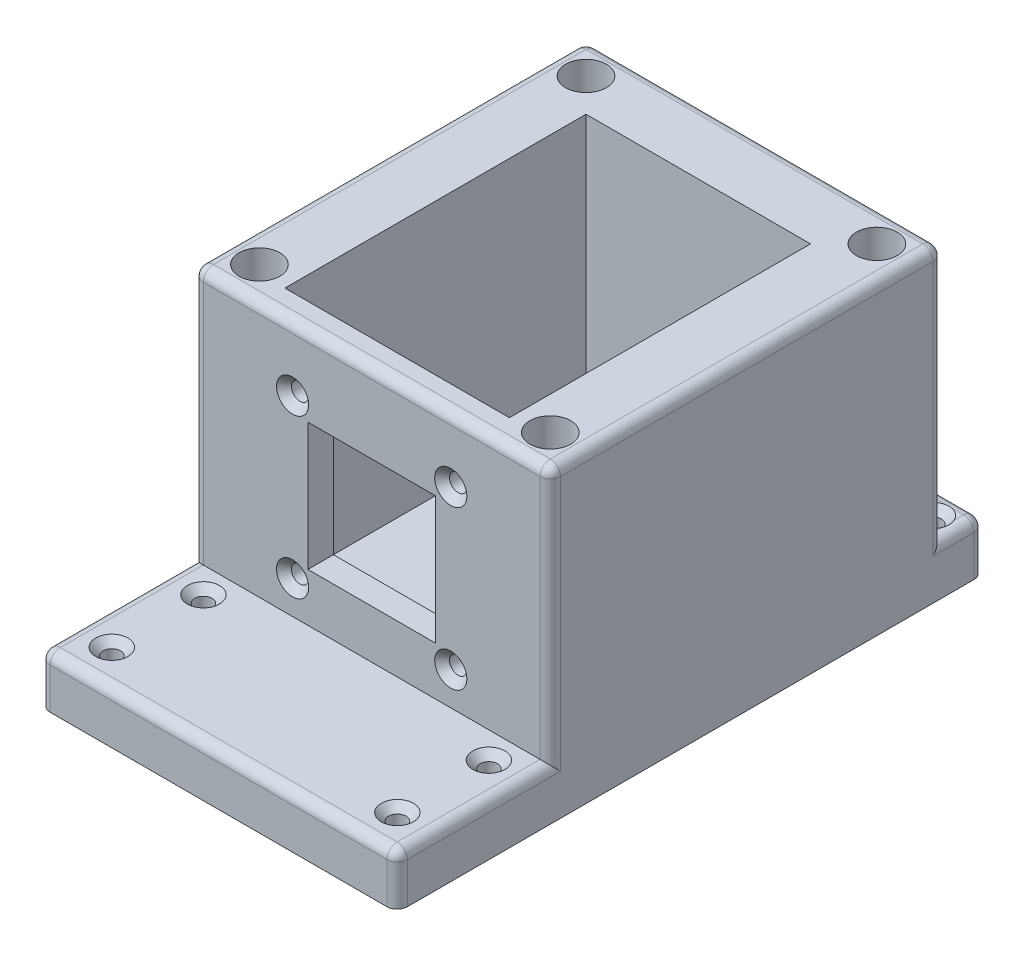
from build123d import *

# Parameters (mm, degrees)
SKETCH2_W                                           = 70
SKETCH2_H                                           = 115
BOSS_EXTRUDE1_DEPTH                                 = 10
SKETCH8_W                                           = 70
SKETCH8_H                                           = 77
SKETCH8_W_2                                         = 44
SKETCH8_H_2                                         = 59
BOSS_EXTRUDE5_DEPTH                                 = 50
SKETCH9_R                                           = 4
CUT_EXTRUDE1_DEPTH                                  = 50
CUT_EXTRUDE2_REACH                                  = 107.948
SKETCH10_W                                          = 25
SKETCH10_H                                          = 25
CSK_FOR_M3_COUNTERSUNK_FLAT_HEAD_SCREW1_D           = 3.4
CSK_FOR_M3_COUNTERSUNK_FLAT_HEAD_SCREW1_DEPTH       = 5
CSK_FOR_M3_COUNTERSUNK_FLAT_HEAD_SCREW1_CSINK_D     = 6.3
CSK_FOR_M3_COUNTERSUNK_FLAT_HEAD_SCREW1_CSINK_ANGLE = 90
FILLET1_R                                           = 2
CSK_FOR_M3_COUNTERSUNK_FLAT_HEAD_SCR_2_COUNT        = 2
CSK_FOR_M3_COUNTERSUNK_FLAT_HEAD_SCR_2_PITCH        = 59.993922781
CSK_FOR_M3_COUNTERSUNK_FLAT_HEAD_SCR_3_COUNT        = 2
CSK_FOR_M3_COUNTERSUNK_FLAT_HEAD_SCR_3_PITCH        = 84.983361201
CSK_FOR_M3_COUNTERSUNK_FLAT_HEAD_SCR_4_COUNT        = 2
CSK_FOR_M3_COUNTERSUNK_FLAT_HEAD_SCR_4_PITCH        = 102.955177918
CSK_FOR_M3_COUNTERSUNK_FLAT_HEAD_SCR_5_COUNT        = 2
CSK_FOR_M3_COUNTERSUNK_FLAT_HEAD_SCR_5_PITCH        = 118.101251225
CSK_FOR_M3_COUNTERSUNK_FLAT_HEAD_SCR_6_COUNT        = 2
CSK_FOR_M3_COUNTERSUNK_FLAT_HEAD_SCR_6_PITCH        = 102.856688561
CSK_FOR_M5_COUNTERSUNK_FLAT_HEAD_SCREW2_D           = 5.5
CSK_FOR_M5_COUNTERSUNK_FLAT_HEAD_SCREW2_DEPTH       = 30
CSK_FOR_M5_COUNTERSUNK_FLAT_HEAD_SCREW2_CSINK_D     = 10.4
CSK_FOR_M5_COUNTERSUNK_FLAT_HEAD_SCREW2_CSINK_ANGLE = 90
CSK_FOR_M5_COUNTERSUNK_FLAT_HEAD_SCREW2_TIP         = 1.652366702


with BuildPart() as part:
    # Sketch2 → Boss-Extrude1 (new body)
    with BuildSketch(Plane(origin=(0, 0, 0), x_dir=(1, 0, 0), z_dir=(0, 1, 0))):
        with Locations((0, 7.5)):
            Rectangle(SKETCH2_W, SKETCH2_H)
    extrude(amount=BOSS_EXTRUDE1_DEPTH)

    # Sketch8 → Boss-Extrude5 (add)
    with BuildSketch(Plane(origin=(0, 10, 0), x_dir=(1, 0, 0), z_dir=(0, 1, 0))):
        with Locations((0, 18.5)):
            Rectangle(SKETCH8_W, SKETCH8_H)
        with Locations((0, 14.5)):
            Rectangle(SKETCH8_W_2, SKETCH8_H_2, mode=Mode.SUBTRACT)
    extrude(amount=BOSS_EXTRUDE5_DEPTH)

    # Sketch9 → Cut-Extrude1 (cut)
    with BuildSketch(Plane(origin=(0, 60, 0), x_dir=(1, 0, 0), z_dir=(0, 1, 0))):
        with Locations(Location((-28.5, 50.5, 0), (0, 0, 270))):
            Circle(SKETCH9_R)
        with Locations(Location((28.5, 50.5, 0), (0, 0, 270))):
            Circle(SKETCH9_R)
        with Locations(Location((28.5, -13.5, 0), (0, 0, 270))):
            Circle(SKETCH9_R)
        with Locations(Location((-28.5, -13.5, 0), (0, 0, 270))):
            Circle(SKETCH9_R)
    extrude(amount=-CUT_EXTRUDE1_DEPTH, mode=Mode.SUBTRACT)

    # Sketch10 → Cut-Extrude2 (cut, up to next)
    with BuildSketch(Plane(origin=(0, 0, 15), x_dir=(-1, 0, 0), z_dir=(0, 0, -1)), mode=Mode.PRIVATE) as cut_extrude2_sk1:
        with Locations((0, 32)):
            Rectangle(SKETCH10_W, SKETCH10_H)
    cut_extrude2_tool1 = extrude(cut_extrude2_sk1.sketch, amount=-CUT_EXTRUDE2_REACH, mode=Mode.PRIVATE) & part.part
    add(cut_extrude2_tool1.solids().sort_by_distance((0, 32, 15))[0], mode=Mode.SUBTRACT)

    # CSK for M3 Countersunk Flat Head Screw1
    with Locations(Plane.XY.offset(20)):
        with Locations((-15.5, 47.5), (15.5, 47.5), (15.5, 16.5), (-15.5, 16.5)):
            CounterSinkHole(CSK_FOR_M3_COUNTERSUNK_FLAT_HEAD_SCREW1_D / 2, CSK_FOR_M3_COUNTERSUNK_FLAT_HEAD_SCREW1_CSINK_D / 2, depth=CSK_FOR_M3_COUNTERSUNK_FLAT_HEAD_SCREW1_DEPTH, counter_sink_angle=CSK_FOR_M3_COUNTERSUNK_FLAT_HEAD_SCREW1_CSINK_ANGLE)

    # Fillet1
    fillet1_edges = [part.edges().sort_by_distance(p)[0] for p in [
        (-35, 10, -61),
        (35, 10, -61),
        (-35, 10, 35),
        (0, 10, 50),
        (-35, 35, 20),
        (35, 35, 20),
        (0, 60, -57),
        (35, 35, -57),
        (-35, 35, -57),
        (0, 60, 20),
        (35, 60, -18.5),
        (-35, 60, -18.5),
        (35, 10, 35),
        (35, 5, 50),
        (-35, 5, 50),
        (-35, 5, -65),
        (35, 5, -65),
        (0, 10, -65),
    ]]
    fillet(fillet1_edges, radius=FILLET1_R)

    # Sketch18 → CSK for M3 Countersunk Flat Head Screw2 (revolve, cut)
    with BuildSketch(Plane(origin=(-29.898999739, 10, -59.914683203), x_dir=(0, 0, 1), z_dir=(1, 0, 0))):
        Polygon((0, 0), (0, 31.021463052), (1.7, 30), (1.7, 1.45), (3.15, 0), align=None)
    csk_for_m3_countersunk_flat_head_screw2 = revolve(axis=Axis((-29.898999739, 16.35, -59.914683203), (0, -1, 0)), mode=Mode.SUBTRACT)

    # CSK for M3 Countersunk Flat Head Scr 2: CSK for M3 Countersunk Flat Head Screw2 ×2
    with Locations(*[Vector(0.999999912683058, 0, 0.00041789218284246394) * (i * CSK_FOR_M3_COUNTERSUNK_FLAT_HEAD_SCR_2_PITCH) for i in range(1, CSK_FOR_M3_COUNTERSUNK_FLAT_HEAD_SCR_2_COUNT)]):
        add(csk_for_m3_countersunk_flat_head_screw2, mode=Mode.SUBTRACT)

    # CSK for M3 Countersunk Flat Head Scr 3: CSK for M3 Countersunk Flat Head Screw2 ×2
    with Locations(*[Vector(0.023234335515626516, 0, 0.9997300463890977) * (i * CSK_FOR_M3_COUNTERSUNK_FLAT_HEAD_SCR_3_PITCH) for i in range(1, CSK_FOR_M3_COUNTERSUNK_FLAT_HEAD_SCR_3_COUNT)]):
        add(csk_for_m3_countersunk_flat_head_screw2, mode=Mode.SUBTRACT)

    # CSK for M3 Countersunk Flat Head Scr 4: CSK for M3 Countersunk Flat Head Screw2 ×2
    with Locations(*[Vector(0.5634477960813598, 0, 0.8261516695444358) * (i * CSK_FOR_M3_COUNTERSUNK_FLAT_HEAD_SCR_4_PITCH) for i in range(1, CSK_FOR_M3_COUNTERSUNK_FLAT_HEAD_SCR_4_COUNT)]):
        add(csk_for_m3_countersunk_flat_head_screw2, mode=Mode.SUBTRACT)

    # CSK for M3 Countersunk Flat Head Scr 5: CSK for M3 Countersunk Flat Head Screw2 ×2
    with Locations(*[Vector(0.4905385745621895, 0, 0.8714194781312243) * (i * CSK_FOR_M3_COUNTERSUNK_FLAT_HEAD_SCR_5_PITCH) for i in range(1, CSK_FOR_M3_COUNTERSUNK_FLAT_HEAD_SCR_5_COUNT)]):
        add(csk_for_m3_countersunk_flat_head_screw2, mode=Mode.SUBTRACT)

    # CSK for M3 Countersunk Flat Head Scr 6: CSK for M3 Countersunk Flat Head Screw2 ×2
    with Locations(*[Vector(0.01850192219633628, 0, 0.9998288247870436) * (i * CSK_FOR_M3_COUNTERSUNK_FLAT_HEAD_SCR_6_PITCH) for i in range(1, CSK_FOR_M3_COUNTERSUNK_FLAT_HEAD_SCR_6_COUNT)]):
        add(csk_for_m3_countersunk_flat_head_screw2, mode=Mode.SUBTRACT)

    # CSK for M5 Countersunk Flat Head Screw2
    with Locations(Plane(origin=(0, 10, 0), x_dir=(1, 0, 0), z_dir=(0, 1, 0))):
        with Locations((0.174986864, 14.411981132)):
            CounterSinkHole(CSK_FOR_M5_COUNTERSUNK_FLAT_HEAD_SCREW2_D / 2, CSK_FOR_M5_COUNTERSUNK_FLAT_HEAD_SCREW2_CSINK_D / 2, depth=CSK_FOR_M5_COUNTERSUNK_FLAT_HEAD_SCREW2_DEPTH, counter_sink_angle=CSK_FOR_M5_COUNTERSUNK_FLAT_HEAD_SCREW2_CSINK_ANGLE)
            with Locations((0, 0, -(CSK_FOR_M5_COUNTERSUNK_FLAT_HEAD_SCREW2_DEPTH + CSK_FOR_M5_COUNTERSUNK_FLAT_HEAD_SCREW2_TIP / 2))):  # 118° drill point
                Cone(0, CSK_FOR_M5_COUNTERSUNK_FLAT_HEAD_SCREW2_D / 2, CSK_FOR_M5_COUNTERSUNK_FLAT_HEAD_SCREW2_TIP, mode=Mode.SUBTRACT)


solid = part.part
